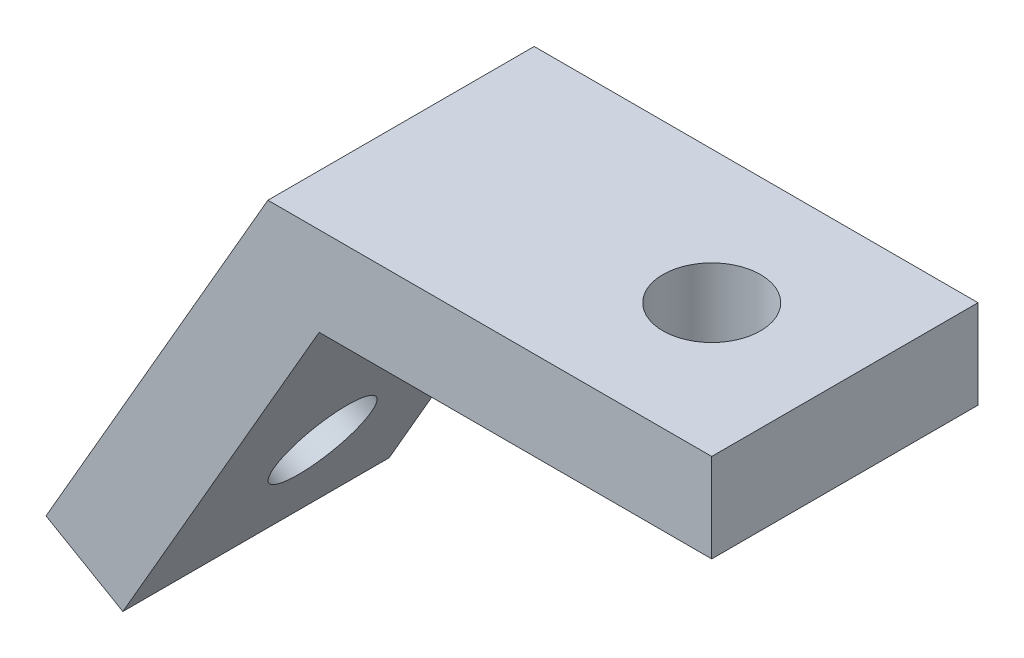
from build123d import *

# Parameters (mm, degrees)
BOSS_EXTRUDE1_DEPTH = 6
SKETCH2_R           = 1.1
CUT_EXTRUDE1_DEPTH  = 6
SKETCH3_R           = 1.1
CUT_EXTRUDE2_DEPTH  = 6


with BuildPart() as part:
    # Sketch1 → Boss-Extrude1 (new body)
    with BuildSketch(Plane.XY):
        Polygon((10.175754196, 4.471206037), (0.175754196, 4.471206037), (-4.824245804, -4.189048001), (-3.092194996, -5.189048001), (1.330454735, 2.471206037), (10.175754196, 2.471206037), align=None)
    extrude(amount=BOSS_EXTRUDE1_DEPTH)

    # Sketch2 → Cut-Extrude1 (cut)
    with BuildSketch(Plane(origin=(0, 4.471206037, 0), x_dir=(1, 0, 0), z_dir=(0, 1, 0))):
        with Locations(Location((7.175754196, -3, 0), (0, 0, 180))):
            Circle(SKETCH2_R)
    extrude(amount=-CUT_EXTRUDE1_DEPTH, mode=Mode.SUBTRACT)

    # Sketch3 → Cut-Extrude2 (cut)
    with BuildSketch(Plane(origin=(-1.80427336, 1.04169771, 0), x_dir=(0, 0, 1), z_dir=(-0.8660254037844399, 0.4999999999999977, 0))):
        with Locations(Location((3, -3.039944888, 0), (0, 0, 270))):
            Circle(SKETCH3_R)
    extrude(amount=-CUT_EXTRUDE2_DEPTH, mode=Mode.SUBTRACT)


solid = part.part
